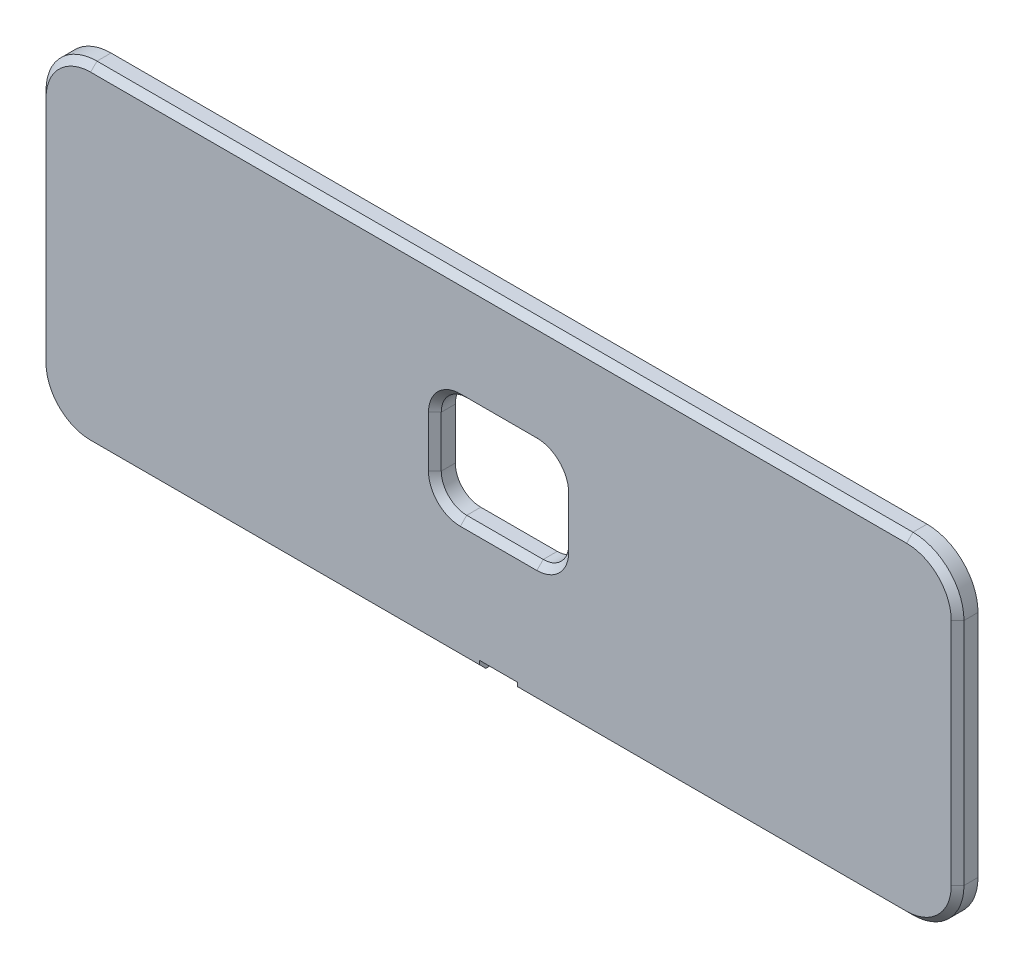
from build123d import *

# Parameters (mm, degrees)
BOSS_EXTRUDE1_START = 78.4
BOSS_EXTRUDE1_DEPTH = 1.6
CHAMFER1_SIZE       = 0.5
BOSS_EXTRUDE2_START = 78
BOSS_EXTRUDE2_DEPTH = 3
CHAMFER2_SIZE       = 0.5
BOSS_EXTRUDE3_START = 79.2
SKETCH3_W           = 3
SKETCH3_H           = 0.9
BOSS_EXTRUDE3_DEPTH = 0.9
BOSS_EXTRUDE4_START = -32
BOSS_EXTRUDE4_DEPTH = 4
BOSS_EXTRUDE5_START = 28
BOSS_EXTRUDE5_DEPTH = 4


with BuildPart() as part:
    # Sketch1 → Boss-Extrude1 (new body)
    with BuildSketch(Plane.XY.offset(BOSS_EXTRUDE1_START)):
        with BuildLine():
            Line((-32, 8.6), (32, 8.6))
            ThreePointArc((32, 8.6), (34.828427125, 9.771572875), (36, 12.6))
            Line((36, 12.6), (36, 30.6))
            ThreePointArc((36, 30.6), (34.828427125, 33.428427125), (32, 34.6))
            Line((32, 34.6), (-32, 34.6))
            ThreePointArc((-32, 34.6), (-34.828427125, 33.428427125), (-36, 30.6))
            Line((-36, 30.6), (-36, 12.6))
            ThreePointArc((-36, 12.6), (-34.828427125, 9.771572875), (-32, 8.6))
        make_face()
    extrude(amount=BOSS_EXTRUDE1_DEPTH)

    # Chamfer1
    chamfer1_edges = [part.edges().sort_by_distance(p)[0] for p in [
        (0, 8.6, 80),
        (34.828427125, 9.771572875, 80),
        (-34.828427125, 9.771572875, 80),
        (36, 21.6, 80),
        (-36, 21.6, 80),
        (34.828427125, 33.428427125, 80),
        (-34.828427125, 33.428427125, 80),
        (0, 34.6, 80),
    ]]
    chamfer(chamfer1_edges, length=CHAMFER1_SIZE)


with BuildPart() as body_2:
    # Sketch2 → Boss-Extrude2 (new body)
    with BuildSketch(Plane.XY.offset(BOSS_EXTRUDE2_START)):
        with BuildLine():
            Line((-3, 18.25), (3, 18.25))
            ThreePointArc((3, 18.25), (4.414213562, 18.835786438), (5, 20.25))
            Line((5, 20.25), (5, 24.25))
            ThreePointArc((5, 24.25), (4.414213562, 25.664213562), (3, 26.25))
            Line((3, 26.25), (-3, 26.25))
            ThreePointArc((-3, 26.25), (-4.414213562, 25.664213562), (-5, 24.25))
            Line((-5, 24.25), (-5, 20.25))
            ThreePointArc((-5, 20.25), (-4.414213562, 18.835786438), (-3, 18.25))
        make_face()
    extrude(amount=BOSS_EXTRUDE2_DEPTH)


with BuildPart() as part_1:
    add(part.part)

    # Combine1: cut body 2
    add(body_2.part, mode=Mode.SUBTRACT)

    # Chamfer2
    chamfer2_edges = [part_1.edges().sort_by_distance(p)[0] for p in [
        (0, 18.25, 80),
        (-4.414213562, 18.835786438, 80),
        (4.414213562, 18.835786438, 80),
        (-5, 22.25, 80),
        (5, 22.25, 80),
        (-4.414213562, 25.664213562, 80),
        (4.414213562, 25.664213562, 80),
        (0, 26.25, 80),
    ]]
    chamfer(chamfer2_edges, length=CHAMFER2_SIZE)


with BuildPart() as body_2_2:
    # Sketch3 → Boss-Extrude3 (new body)
    with BuildSketch(Plane.XY.offset(BOSS_EXTRUDE3_START)):
        with Locations((0, 8.95)):
            Rectangle(SKETCH3_W, SKETCH3_H)
    extrude(amount=BOSS_EXTRUDE3_DEPTH)


with BuildPart() as part_2:
    add(part_1.part)

    # Combine2: cut body 2 2
    add(body_2_2.part, mode=Mode.SUBTRACT)

    # Sketch4 → Boss-Extrude4 (add)
    with BuildSketch(Plane(origin=(0, 0, 0), x_dir=(0, 0, -1), z_dir=(1, 0, 0)).offset(BOSS_EXTRUDE4_START)):
        Polygon((-78.41, 12), (-74.6, 12), (-74.6, 12.8), (-74.9, 13.1), (-75.2, 13.1), (-75.2, 12.8), (-78.41, 12.8), align=None)
    extrude(amount=BOSS_EXTRUDE4_DEPTH)

    # Sketch5 → Boss-Extrude5 (add)
    with BuildSketch(Plane(origin=(0, 0, 0), x_dir=(0, 0, -1), z_dir=(1, 0, 0)).offset(BOSS_EXTRUDE5_START)):
        Polygon((-78.41, 12), (-74.6, 12), (-74.6, 12.8), (-74.9, 13.1), (-75.2, 13.1), (-75.2, 12.8), (-78.41, 12.8), align=None)
    extrude(amount=BOSS_EXTRUDE5_DEPTH)


solid = part_2.part
